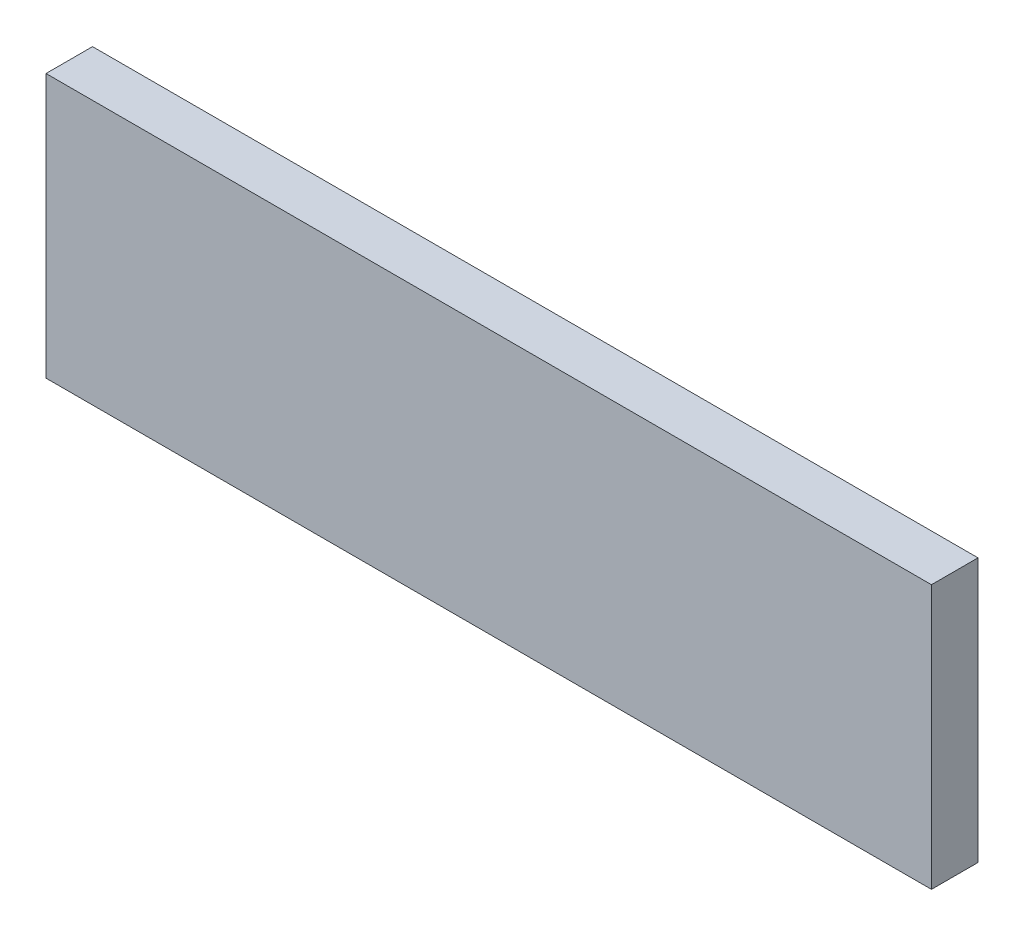
from build123d import *

# Parameters (mm, degrees)
SKETCH1_W               = 19.0246
SKETCH1_H               = 5.6693
COMPONENT_OUTLINE_DEPTH = 1


with BuildPart() as part:
    # Sketch1 → Component_Outline (new body)
    with BuildSketch(Plane.XY):
        with Locations((9.525, 2.85245)):
            Rectangle(SKETCH1_W, SKETCH1_H)
    extrude(amount=COMPONENT_OUTLINE_DEPTH)


solid = part.part
